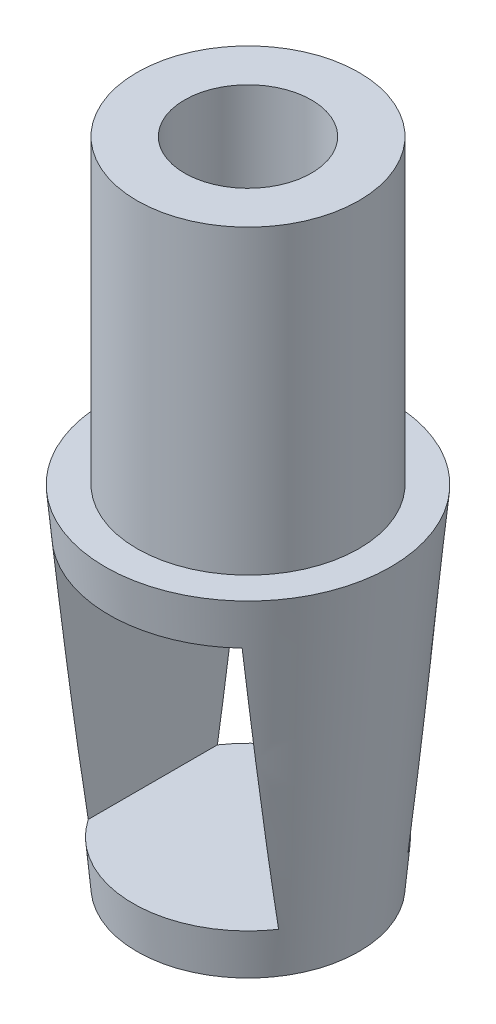
from build123d import *

# Parameters (mm, degrees)
SKETCH3_R               = 7
BOSS_EXTRUDE1_DEPTH     = 19
SKETCH4_R               = 4
CUT_EXTRUDE1_DEPTH      = 19
CUT_EXTRUDE2_DEPTH      = 26.416530054
CUT_EXTRUDE2_DEPTH_BACK = 26.416530054
SKETCH5_W               = 12
SKETCH5_H               = 16.5


with BuildPart() as part:
    # Sketch2 → Revolve2 (revolve)
    with BuildSketch(Plane.XY, mode=Mode.PRIVATE) as revolve2_sk:
        Polygon((0, 0), (9, 0), (7, -22), (0, -22), align=None)
    revolve(revolve2_sk.sketch.rotate(Axis((0, 0, 0), (0, -1, 0)), 180), axis=Axis((0, 0, 0), (0, -1, 0)))

    # Sketch3 → Boss-Extrude1 (add)
    with BuildSketch(Plane(origin=(0, 0, 0), x_dir=(1, 0, 0), z_dir=(0, 1, 0))):
        with Locations(Location((0, 0, 0), (0, 0, 180))):
            Circle(SKETCH3_R)
    extrude(amount=BOSS_EXTRUDE1_DEPTH)

    # Sketch4 → Cut-Extrude1 (cut)
    with BuildSketch(Plane(origin=(0, 19, 0), x_dir=(1, 0, 0), z_dir=(0, 1, 0))):
        with Locations(Location((0, 0, 0), (0, 0, 180))):
            Circle(SKETCH4_R)
    extrude(amount=-CUT_EXTRUDE1_DEPTH, mode=Mode.SUBTRACT)

    # Sketch5 → Cut-Extrude2 (cut, two sides: drawn at the far end of the back side and taken through both)
    with BuildSketch(Plane.XY.offset(-CUT_EXTRUDE2_DEPTH_BACK)):
        with Locations((0, -11)):
            Rectangle(SKETCH5_W, SKETCH5_H)
    extrude(amount=CUT_EXTRUDE2_DEPTH + CUT_EXTRUDE2_DEPTH_BACK, mode=Mode.SUBTRACT)


solid = part.part
